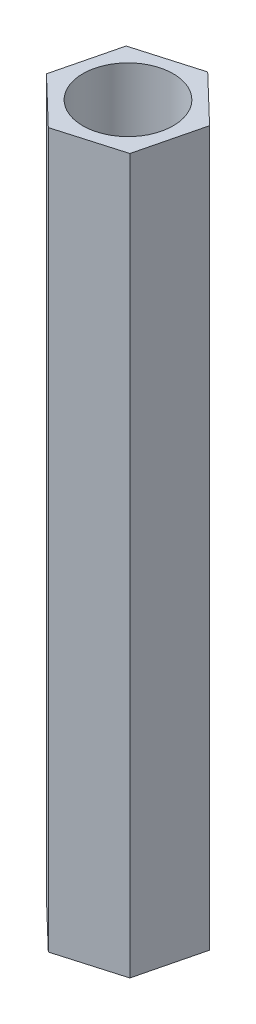
from build123d import *

# Parameters (mm, degrees)
BOSS_EXTRUDE1_DEPTH = 20.66
SKETCH2_R           = 1.307810537
CUT_EXTRUDE1_DEPTH  = 20.66


with BuildPart() as part:
    # Sketch1 → Boss-Extrude1 (new body)
    with BuildSketch(Plane(origin=(0, 0, 0), x_dir=(1, 0, 0), z_dir=(0, 1, 0))):
        Polygon((1.829961684, 0.530320878), (0.455709489, 1.849953746), (-1.374252195, 1.319632867), (-1.829961684, -0.530320878), (-0.455709489, -1.849953746), (1.374252195, -1.319632867), align=None)
    extrude(amount=BOSS_EXTRUDE1_DEPTH)

    # Sketch2 → Cut-Extrude1 (cut)
    with BuildSketch(Plane(origin=(0, 20.66, 0), x_dir=(1, 0, 0), z_dir=(0, 1, 0))):
        with Locations(Location((0, 0, 0), (0, 0, 270))):
            Circle(SKETCH2_R)
    extrude(amount=-CUT_EXTRUDE1_DEPTH, mode=Mode.SUBTRACT)


solid = part.part
